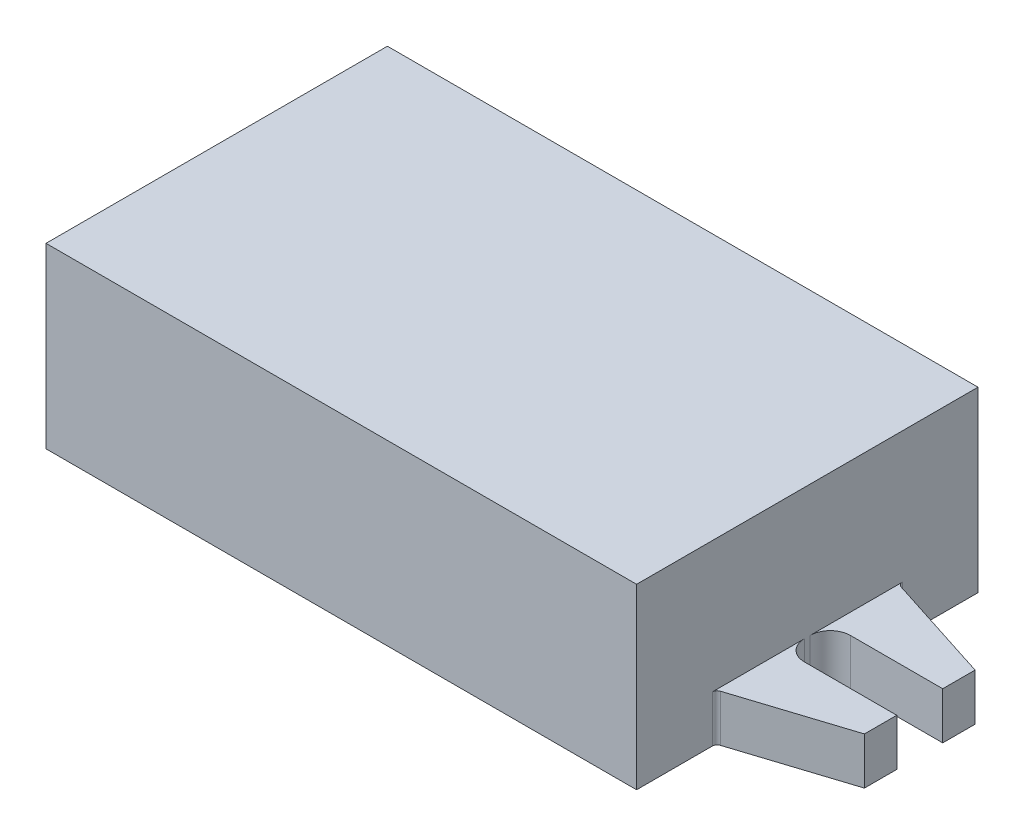
from build123d import *

# Parameters (mm, degrees)
BOSS_EXTRUDE1_DEPTH = 3.683
SKETCH2_W           = 46.355
SKETCH2_H           = 26.797
BOSS_EXTRUDE2_DEPTH = 10.287


with BuildPart() as part:
    # Sketch1 → Boss-Extrude1 (new body)
    with BuildSketch(Plane(origin=(0, 0, 0), x_dir=(1, 0, 0), z_dir=(0, 1, 0))):
        with BuildLine():
            Line((0, 0), (46.355, 0))
            Line((46.355, 0), (46.355, 5.945116694))
            ThreePointArc((46.355, 5.945116694), (46.428176367, 6.169628633), (46.619596382, 6.307899271))
            Line((46.619596382, 6.307899271), (55.1815, 9.0551))
            Line((55.1815, 9.0551), (55.1815, 11.5951))
            Line((55.1815, 11.5951), (47.9298, 11.5951))
            ThreePointArc((47.9298, 11.5951), (46.816248241, 12.056348241), (46.355, 13.1699))
            Line((46.355, 13.1699), (46.355, 13.6271))
            ThreePointArc((46.355, 13.6271), (46.816248241, 14.740651759), (47.9298, 15.2019))
            Line((47.9298, 15.2019), (55.1815, 15.2019))
            Line((55.1815, 15.2019), (55.1815, 17.7419))
            Line((55.1815, 17.7419), (46.619596382, 20.489100729))
            ThreePointArc((46.619596382, 20.489100729), (46.428176367, 20.627371367), (46.355, 20.851883306))
            Line((46.355, 20.851883306), (46.355, 26.797))
            Line((46.355, 26.797), (0, 26.797))
            Line((0, 26.797), (0, 20.851883306))
            ThreePointArc((0, 20.851883306), (-0.073176367, 20.627371367), (-0.264596382, 20.489100729))
            Line((-0.264596382, 20.489100729), (-8.8265, 17.7419))
            Line((-8.8265, 17.7419), (-8.8265, 15.2019))
            Line((-8.8265, 15.2019), (-1.5748, 15.2019))
            ThreePointArc((-1.5748, 15.2019), (-0.461248241, 14.740651759), (0, 13.6271))
            Line((0, 13.6271), (0, 13.1699))
            ThreePointArc((0, 13.1699), (-0.461248241, 12.056348241), (-1.5748, 11.5951))
            Line((-1.5748, 11.5951), (-8.8265, 11.5951))
            Line((-8.8265, 11.5951), (-8.8265, 9.0551))
            Line((-8.8265, 9.0551), (-0.264596382, 6.307899271))
            ThreePointArc((-0.264596382, 6.307899271), (-0.073176367, 6.169628633), (0, 5.945116694))
            Line((0, 5.945116694), (0, 0))
        make_face()
    extrude(amount=BOSS_EXTRUDE1_DEPTH)

    # Sketch2 → Boss-Extrude2 (add)
    with BuildSketch(Plane(origin=(0, 3.683, 0), x_dir=(1, 0, 0), z_dir=(0, 1, 0))):
        with Locations((23.1775, 13.3985)):
            Rectangle(SKETCH2_W, SKETCH2_H)
    extrude(amount=BOSS_EXTRUDE2_DEPTH)


solid = part.part
